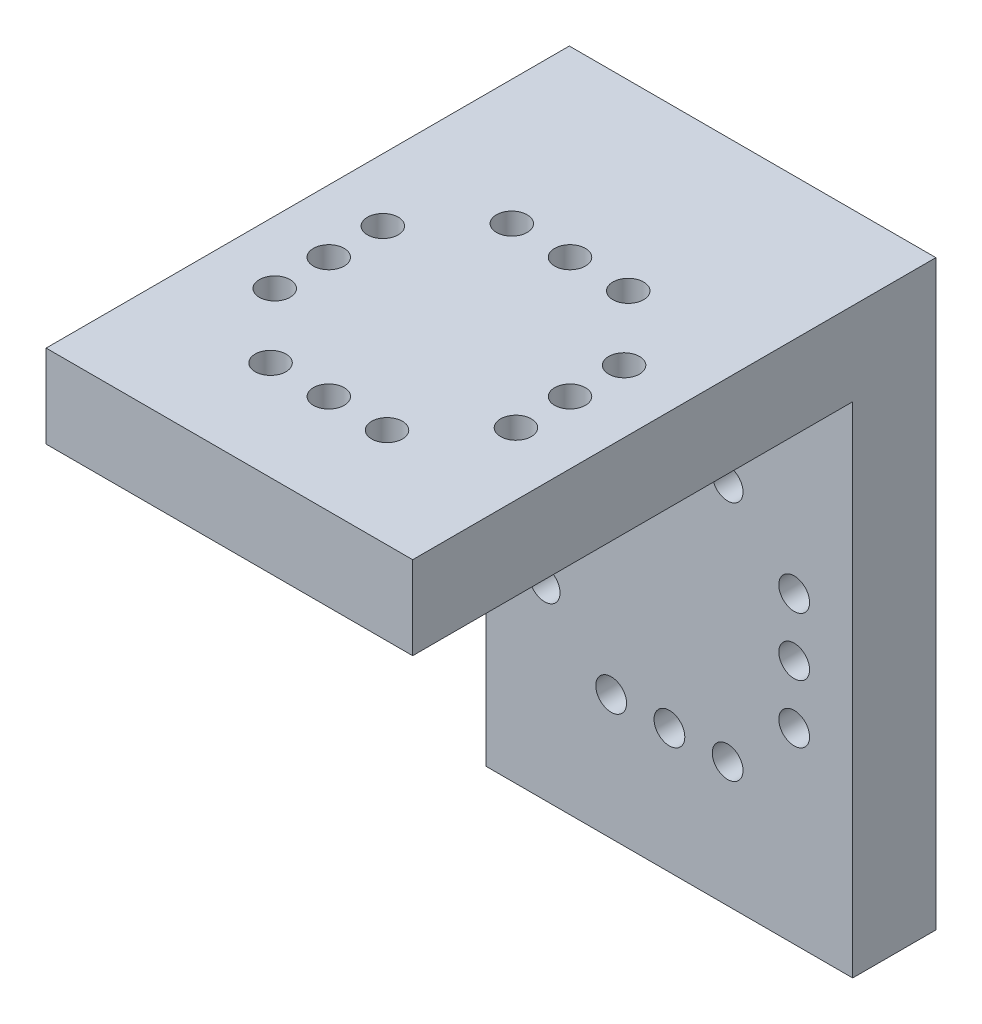
from build123d import *

# Parameters (mm, degrees)
SKETCH_1_W          = 22.033021484
SKETCH_1_H          = 26.449100754
SKETCH_1_R          = 0.925
EXTRUDE_1_DEPTH     = 5
SKETCH_1_3_W        = 22.033021484
SKETCH_1_3_H        = 5
EXTRUDE_2_DEPTH     = 35
SKETCH_3_R          = 0.925
CUT_EXTRUDE_1_DEPTH = 25


with BuildPart() as part:
    # Эскиз1 → Бобышка-Вытянуть1 (new body)
    with BuildSketch(Plane(origin=(0, 0, 0), x_dir=(1, 0, 0), z_dir=(0, 1, 0))):
        Rectangle(SKETCH_1_W, SKETCH_1_H)
        with Locations((-3.5, -7.25)):
            Circle(SKETCH_1_R, mode=Mode.SUBTRACT)
        with Locations((-7.25, -3.25)):
            Circle(SKETCH_1_R, mode=Mode.SUBTRACT)
        with Locations((-7.25, 0)):
            Circle(SKETCH_1_R, mode=Mode.SUBTRACT)
        with Locations((0, -7.25)):
            Circle(SKETCH_1_R, mode=Mode.SUBTRACT)
        with Locations((3.5, -7.25)):
            Circle(SKETCH_1_R, mode=Mode.SUBTRACT)
        with Locations((7.25, -3.25)):
            Circle(SKETCH_1_R, mode=Mode.SUBTRACT)
        with Locations((7.25, 0)):
            Circle(SKETCH_1_R, mode=Mode.SUBTRACT)
        with Locations((-7.25, 3.25)):
            Circle(SKETCH_1_R, mode=Mode.SUBTRACT)
        with Locations((-3.5, 7.25)):
            Circle(SKETCH_1_R, mode=Mode.SUBTRACT)
        with Locations((0, 7.25)):
            Circle(SKETCH_1_R, mode=Mode.SUBTRACT)
        with Locations((3.5, 7.25)):
            Circle(SKETCH_1_R, mode=Mode.SUBTRACT)
        with Locations((7.25, 3.25)):
            Circle(SKETCH_1_R, mode=Mode.SUBTRACT)
    extrude(amount=-EXTRUDE_1_DEPTH)

    # Эскиз1<3> → Бобышка-Вытянуть2 (add)
    with BuildSketch(Plane(origin=(0, 0, 0), x_dir=(1, 0, 0), z_dir=(0, 1, 0))):
        with Locations((0, 15.724550377)):
            Rectangle(SKETCH_1_3_W, SKETCH_1_3_H)
    extrude(amount=-EXTRUDE_2_DEPTH)

    # Эскиз3 → Вырез-Вытянуть1 (cut)
    with BuildSketch(Plane.XY.offset(-13.224550377)):
        with Locations((0, -13)):
            Circle(SKETCH_3_R)
        with Locations((-3.5, -13)):
            Circle(SKETCH_3_R)
        with Locations((3.5, -13)):
            Circle(SKETCH_3_R)
        with Locations((3.5, -27.5)):
            Circle(SKETCH_3_R)
        with Locations((0, -27.5)):
            Circle(SKETCH_3_R)
        with Locations((-3.5, -27.5)):
            Circle(SKETCH_3_R)
        with Locations((-7.5, -20.25)):
            Circle(SKETCH_3_R)
        with Locations((-7.5, -16.75)):
            Circle(SKETCH_3_R)
        with Locations((-7.5, -23.75)):
            Circle(SKETCH_3_R)
        with Locations((7.5, -16.75)):
            Circle(SKETCH_3_R)
        with Locations((7.5, -20.25)):
            Circle(SKETCH_3_R)
        with Locations((7.5, -23.75)):
            Circle(SKETCH_3_R)
    extrude(amount=-CUT_EXTRUDE_1_DEPTH, mode=Mode.SUBTRACT)


solid = part.part
